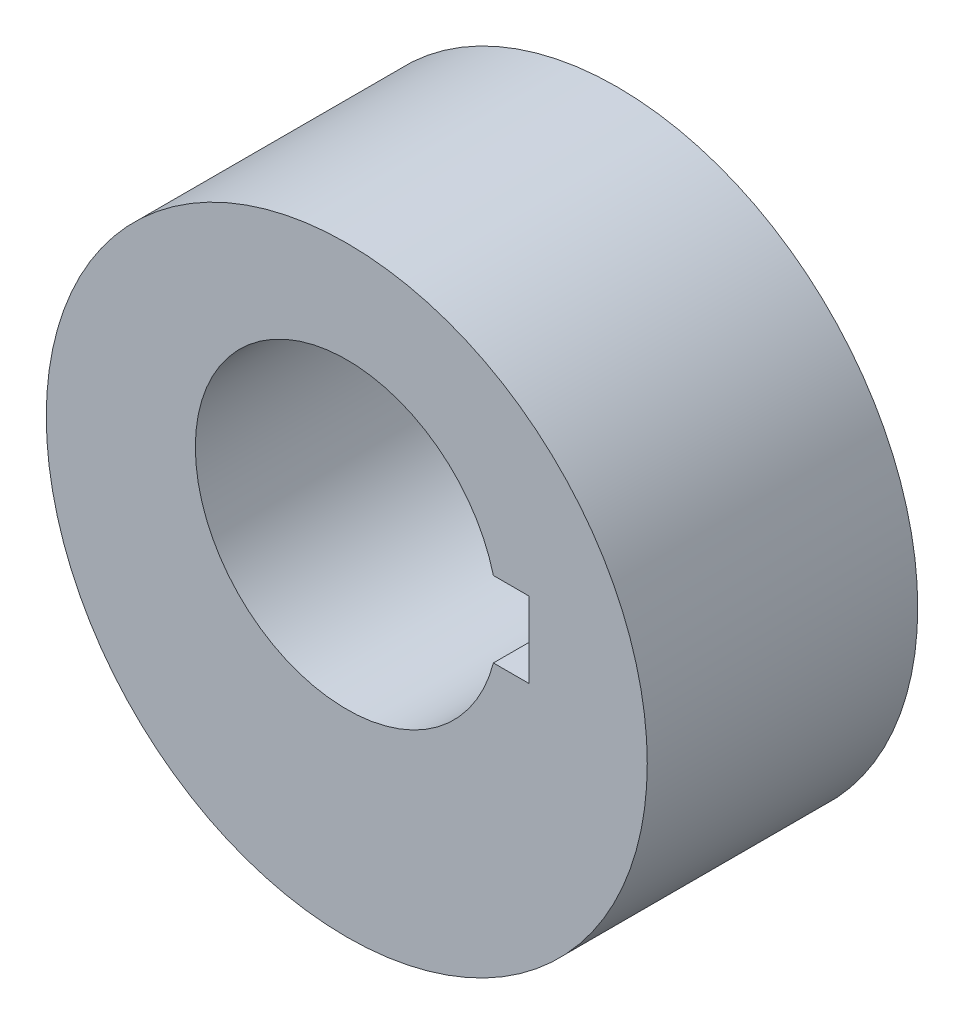
from build123d import *

# Parameters (mm, degrees)
SKETCH1_R           = 7.9375
SKETCH1_R_2         = 4
BOSS_EXTRUDE1_DEPTH = 7.14375
CUT_EXTRUDE2_DEPTH  = 14.3056746


with BuildPart() as part:
    # Sketch1 → Boss-Extrude1 (new body)
    with BuildSketch(Plane.XY):
        Circle(SKETCH1_R)
        with Locations((0, 1.27)):
            Circle(SKETCH1_R_2, mode=Mode.SUBTRACT)
    extrude(amount=BOSS_EXTRUDE1_DEPTH)

    # Sketch8 → Cut-Extrude2 (cut, through all)
    with BuildSketch(Plane(origin=(0, 0, 0), x_dir=(-1, 0, 0), z_dir=(0, 0, -1))):
        Polygon((-4, 0.27), (-4.809500032, 0.27), (-4.809500032, 2.27), (-4, 2.27), (-3.872983346, 2.27), (-3.872983346, 0.27), align=None)
    extrude(amount=-CUT_EXTRUDE2_DEPTH, mode=Mode.SUBTRACT)


solid = part.part
